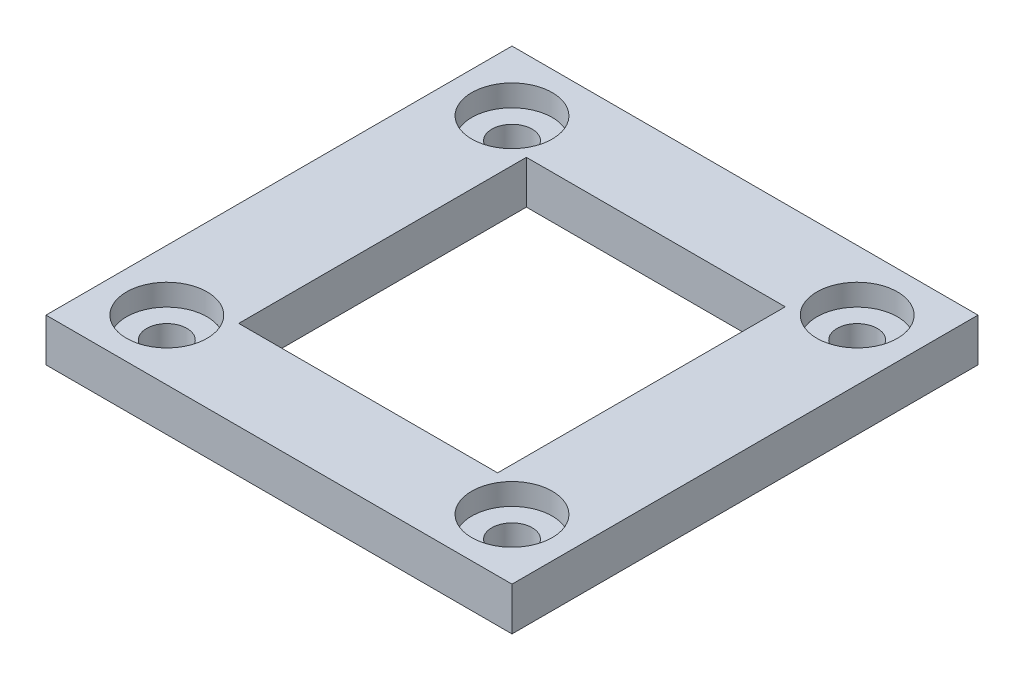
from build123d import *

# Parameters (mm, degrees)
SKETCH1_W                        = 32.4
SKETCH1_H                        = 32.4
BOSS_EXTRUDE1_DEPTH              = 3
CBORE_FOR_M1_6_SHCS1_D           = 2.8
CBORE_FOR_M1_6_SHCS1_CBORE_D     = 5.6
CBORE_FOR_M1_6_SHCS1_CBORE_DEPTH = 1.5
SKETCH5_W                        = 18
SKETCH5_H                        = 20
CUT_EXTRUDE1_DEPTH               = 46.918623673


with BuildPart() as part:
    # Sketch1 → Boss-Extrude1 (new body)
    with BuildSketch(Plane(origin=(0, 0, 0), x_dir=(1, 0, 0), z_dir=(0, 1, 0))):
        with Locations((16.2, 16.2)):
            Rectangle(SKETCH1_W, SKETCH1_H)
    extrude(amount=BOSS_EXTRUDE1_DEPTH)

    # CBORE for M1.6 SHCS1 (through all)
    with Locations(Plane(origin=(0, 3, 0), x_dir=(1, 0, 0), z_dir=(0, 1, 0))):
        with Locations((4.2, 28.2), (28.2, 28.2), (28.2, 4.2), (4.2, 4.2)):
            CounterBoreHole(CBORE_FOR_M1_6_SHCS1_D / 2, CBORE_FOR_M1_6_SHCS1_CBORE_D / 2, CBORE_FOR_M1_6_SHCS1_CBORE_DEPTH)

    # Sketch5 → Cut-Extrude1 (cut, through all)
    with BuildSketch(Plane(origin=(0, 3, 0), x_dir=(1, 0, 0), z_dir=(0, 1, 0))):
        with Locations((16.2, 16.2)):
            Rectangle(SKETCH5_W, SKETCH5_H)
    extrude(amount=-CUT_EXTRUDE1_DEPTH, mode=Mode.SUBTRACT)


solid = part.part
